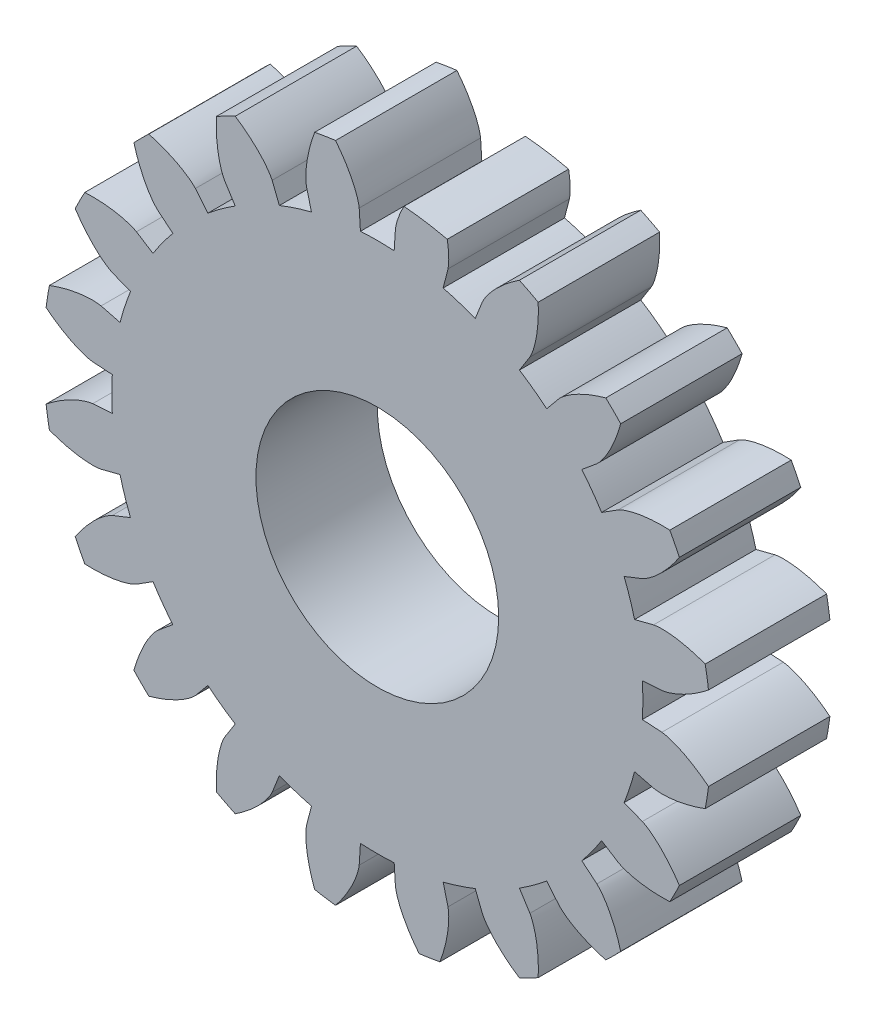
from build123d import *

# Parameters (mm, degrees)
SKETCH1_R           = 27.5
BOSS_EXTRUDE1_DEPTH = 5
CUT_EXTRUDE1_DEPTH  = 41.155946011
CUT_EXTRUDE2_DEPTH  = 41.155946172
CIRPATTERN1_COUNT   = 20
SKETCH5_R           = 10
CUT_EXTRUDE3_DEPTH  = 40.860026837
CUT_EXTRUDE5_DEPTH  = 40.860026837


with BuildPart() as part:
    # Sketch1 → Boss-Extrude1 (new, symmetric)
    with BuildSketch(Plane.XY):
        Circle(SKETCH1_R)
    extrude(amount=BOSS_EXTRUDE1_DEPTH, both=True)

    # Sketch2 → Cut-Extrude1 (cut, through all)
    with BuildSketch(Plane.XY.offset(5)):
        with BuildLine():
            ThreePointArc((-1.492192858, 23.442556611), (0, 23.49), (1.492192858, 23.442556611))
            add(Edge.make_bspline(
                [(1.492192858, 23.442556611), (1.509703149, 23.613515204), (1.598056956, 23.990887646), (1.822980926, 24.640546676), (2.205804226, 25.458419905), (3.090420272, 26.93307024), (4.021139918, 28.014218864), (4.755897678, 28.734820989)],
                knots=[0, 0, 0, 0, 0.081635884, 0.183676701, 0.326533469, 0.510206256, 1, 1, 1, 1], degree=3))
            ThreePointArc((4.755897678, 28.734820989), (0, 29.149189424), (-4.755897678, 28.734820989))
            add(Edge.make_bspline(
                [(-1.492192858, 23.442556611), (-1.509703149, 23.613515204), (-1.598056956, 23.990887646), (-1.822980926, 24.640546676), (-2.205804226, 25.458419905), (-3.090420272, 26.93307024), (-4.021139918, 28.014218864), (-4.755897678, 28.734820989)],
                knots=[0, 0, 0, 0, 0.081635884, 0.183676701, 0.326533469, 0.510206256, 1, 1, 1, 1], degree=3))
        make_face()
    cut_extrude1 = extrude(amount=-CUT_EXTRUDE1_DEPTH, mode=Mode.SUBTRACT)

    # Sketch4 → Cut-Extrude2 (cut, through all)
    with BuildSketch(Plane.XY.offset(5)):
        with BuildLine():
            Line((-1.492192858, 23.442556611), (-1.389600629, 21.830818471))
            ThreePointArc((-1.389600629, 21.830818471), (0, 21.875), (1.389600629, 21.830818471))
            Line((1.389600629, 21.830818471), (1.492192858, 23.442556611))
            ThreePointArc((1.492192858, 23.442556611), (0, 23.49), (-1.492192858, 23.442556611))
        make_face()
    cut_extrude2 = extrude(amount=-CUT_EXTRUDE2_DEPTH, mode=Mode.SUBTRACT)

    # CirPattern1: Cut-Extrude1, Cut-Extrude2 ×20 about axis
    cirpattern1_axis = Axis((0, 0, 5), (0, 0, -1))
    add([cut_extrude1.rotate(cirpattern1_axis, i * 360 / CIRPATTERN1_COUNT) for i in range(1, CIRPATTERN1_COUNT)], mode=Mode.SUBTRACT)
    add([cut_extrude2.rotate(cirpattern1_axis, i * 360 / CIRPATTERN1_COUNT) for i in range(1, CIRPATTERN1_COUNT)], mode=Mode.SUBTRACT)

    # Sketch5 → Cut-Extrude3 (cut, through all)
    with BuildSketch(Plane.XY.offset(5)):
        Circle(SKETCH5_R)
    extrude(amount=-CUT_EXTRUDE3_DEPTH, mode=Mode.SUBTRACT)

    # Sketch9 → Cut-Extrude5 (cut, through all)
    with BuildSketch(Plane.XY.offset(5)):
        with BuildLine():
            ThreePointArc((1.619877304, 25.44849696), (3.989078859, 25.186052685), (6.323423176, 24.703528479))
            Line((6.323423176, 24.703528479), (6.819377935, 26.641060125))
            ThreePointArc((6.819377935, 26.641060125), (4.301947789, 27.161429366), (1.746926505, 27.444457506))
            Line((1.746926505, 27.444457506), (1.619877304, 25.44849696))
        make_face()
    extrude(amount=-CUT_EXTRUDE5_DEPTH, mode=Mode.SUBTRACT)


solid = part.part
